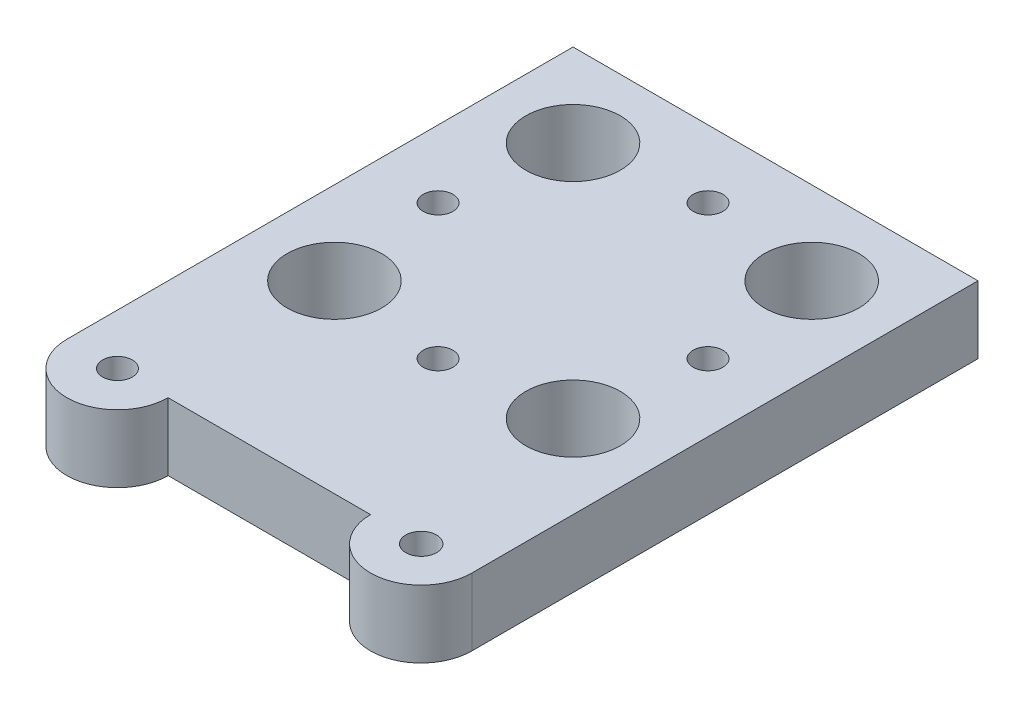
from build123d import *

# Parameters (mm, degrees)
SKETCH_1_W          = 60
SKETCH_1_H          = 60
EXTRUDE_1_DEPTH     = 10
SKETCH_2_R          = 2.2
CUT_EXTRUDE_1_DEPTH = 10
CUT_EXTRUDE_2_DEPTH = 3.5
SKETCH_4_R          = 7
CUT_EXTRUDE_3_DEPTH = 44.588989435
SKETCH_5_W          = 60
SKETCH_5_H          = 10
EXTRUDE_2_DEPTH     = 15
EXTRUDE_3_DEPTH     = 10
SKETCH_7_R          = 2.27814783
SKETCH_7_R_2        = 2.2
CUT_EXTRUDE_4_DEPTH = 62.288253361
SKETCH_8_R          = 4
CUT_EXTRUDE_5_DEPTH = 4


with BuildPart() as part:
    # 草图1 → 凸台-拉伸1 (new body)
    with BuildSketch(Plane(origin=(0, 0, 0), x_dir=(1, 0, 0), z_dir=(0, 1, 0))):
        Rectangle(SKETCH_1_W, SKETCH_1_H)
    extrude(amount=EXTRUDE_1_DEPTH)

    # 草图2 → 切除-拉伸1 (cut)
    with BuildSketch(Plane(origin=(0, 10, 0), x_dir=(1, 0, 0), z_dir=(0, 1, 0))):
        with Locations(Location((0, 20, 0), (0, 0, 270))):
            Circle(SKETCH_2_R)
        with Locations(Location((-20, 0, 0), (0, 0, 270))):
            Circle(SKETCH_2_R)
        with Locations(Location((0, -20, 0), (0, 0, 270))):
            Circle(SKETCH_2_R)
        with Locations(Location((20, 0, 0), (0, 0, 270))):
            Circle(SKETCH_2_R)
    extrude(amount=-CUT_EXTRUDE_1_DEPTH, mode=Mode.SUBTRACT)

    # 草图3 → 切除-拉伸2 (cut)
    with BuildSketch(Plane.XZ):
        Polygon((4, 20), (2, 23.464101615), (-2, 23.464101615), (-4, 20), (-2, 16.535898385), (2, 16.535898385), align=None)
        Polygon((-16, 0), (-18, 3.464101615), (-22, 3.464101615), (-24, 0), (-22, -3.464101615), (-18, -3.464101615), align=None)
        Polygon((24, 0), (22, 3.464101615), (18, 3.464101615), (16, 0), (18, -3.464101615), (22, -3.464101615), align=None)
        Polygon((4, -20), (2, -16.535898385), (-2, -16.535898385), (-4, -20), (-2, -23.464101615), (2, -23.464101615), align=None)
    extrude(amount=-CUT_EXTRUDE_2_DEPTH, mode=Mode.SUBTRACT)

    # 草图4 → 切除-拉伸3 (cut, through all)
    with BuildSketch(Plane.XZ):
        with Locations(Location((-17.67766953, 17.67766953, 0), (0, 0, 270))):
            Circle(SKETCH_4_R)
        with Locations(Location((-17.67766953, -17.67766953, 0), (0, 0, 270))):
            Circle(SKETCH_4_R)
        with Locations(Location((17.67766953, -17.67766953, 0), (0, 0, 270))):
            Circle(SKETCH_4_R)
        with Locations(Location((17.67766953, 17.67766953, 0), (0, 0, 270))):
            Circle(SKETCH_4_R)
    extrude(amount=-CUT_EXTRUDE_3_DEPTH, mode=Mode.SUBTRACT)

    # 草图5 → 凸台-拉伸2 (add)
    with BuildSketch(Plane.XY.offset(30)):
        with Locations((0, 5)):
            Rectangle(SKETCH_5_W, SKETCH_5_H)
    extrude(amount=EXTRUDE_2_DEPTH)

    # 草图6 → 凸台-拉伸3 (add)
    with BuildSketch(Plane(origin=(0, 10, 0), x_dir=(1, 0, 0), z_dir=(0, 1, 0))):
        with BuildLine():
            ThreePointArc((-30, -45), (-27.341229183, -50.728219619), (-21.25, -52.395099729))
            ThreePointArc((-21.25, -52.395099729), (-21.97543719, -49.830130464), (-22.392444444, -47.197369291))
            ThreePointArc((-22.392444444, -47.197369291), (-24.017131797, -46.593207805), (-24.7, -45))
            Line((-24.7, -45), (-30, -45))
        make_face()
        with BuildLine():
            ThreePointArc((-22.392444444, -47.197369291), (-21.97543719, -49.830130464), (-21.25, -52.395099729))
            ThreePointArc((-21.25, -52.395099729), (-16.771780381, -49.841229183), (-15, -45))
            Line((-15, -45), (-20.3, -45))
            ThreePointArc((-20.3, -45), (-20.906792195, -46.517131797), (-22.392444444, -47.197369291))
        make_face()
        with BuildLine():
            Line((-20.3, -45), (-15, -45))
            ThreePointArc((-15, -45), (-16.771780381, -40.158770817), (-21.25, -37.604900271))
            ThreePointArc((-21.25, -37.604900271), (-21.97543719, -40.169869536), (-22.392444444, -42.802630709))
            ThreePointArc((-22.392444444, -42.802630709), (-20.906792195, -43.482868203), (-20.3, -45))
        make_face()
        with BuildLine():
            ThreePointArc((-21.25, -37.604900271), (-27.341229183, -39.271780381), (-30, -45))
            Line((-30, -45), (-24.7, -45))
            ThreePointArc((-24.7, -45), (-24.017131797, -43.406792195), (-22.392444444, -42.802630709))
            ThreePointArc((-22.392444444, -42.802630709), (-21.97543719, -40.169869536), (-21.25, -37.604900271))
        make_face()
        with BuildLine():
            ThreePointArc((21.25, -52.395099729), (27.341229183, -50.728219619), (30, -45))
            Line((30, -45), (24.7, -45))
            ThreePointArc((24.7, -45), (24.017131797, -46.593207805), (22.392444444, -47.197369291))
            ThreePointArc((22.392444444, -47.197369291), (21.97543719, -49.830130464), (21.25, -52.395099729))
        make_face()
        with BuildLine():
            Line((24.7, -45), (30, -45))
            ThreePointArc((30, -45), (27.341229183, -39.271780381), (21.25, -37.604900271))
            ThreePointArc((21.25, -37.604900271), (21.97543719, -40.169869536), (22.392444444, -42.802630709))
            ThreePointArc((22.392444444, -42.802630709), (24.017131797, -43.406792195), (24.7, -45))
        make_face()
        with BuildLine():
            ThreePointArc((22.392444444, -42.802630709), (21.97543719, -40.169869536), (21.25, -37.604900271))
            ThreePointArc((21.25, -37.604900271), (16.771780381, -40.158770817), (15, -45))
            Line((15, -45), (20.3, -45))
            ThreePointArc((20.3, -45), (20.906792195, -43.482868203), (22.392444444, -42.802630709))
        make_face()
        with BuildLine():
            ThreePointArc((15, -45), (16.771780381, -49.841229183), (21.25, -52.395099729))
            ThreePointArc((21.25, -52.395099729), (21.97543719, -49.830130464), (22.392444444, -47.197369291))
            ThreePointArc((22.392444444, -47.197369291), (20.906792195, -46.517131797), (20.3, -45))
            Line((20.3, -45), (15, -45))
        make_face()
    extrude(amount=-EXTRUDE_3_DEPTH)

    # 草图7 → 切除-拉伸4 (cut, through all)
    with BuildSketch(Plane(origin=(0, 10, 0), x_dir=(1, 0, 0), z_dir=(0, 1, 0))):
        with Locations(Location((22.5, -45, 0), (0, 0, 270))):
            Circle(SKETCH_7_R)
        with Locations(Location((-22.5, -45, 0), (0, 0, 270))):
            Circle(SKETCH_7_R_2)
    extrude(amount=-CUT_EXTRUDE_4_DEPTH, mode=Mode.SUBTRACT)

    # 草图8 → 切除-拉伸5 (cut)
    with BuildSketch(Plane(origin=(0, 0, 0), x_dir=(-1, 0, 0), z_dir=(0, -1, 0))):
        with Locations(Location((-22.5, -45, 0), (0, 0, 90))):
            Circle(SKETCH_8_R)
        with Locations(Location((22.5, -45, 0), (0, 0, 90))):
            Circle(SKETCH_8_R)
    extrude(amount=-CUT_EXTRUDE_5_DEPTH, mode=Mode.SUBTRACT)


solid = part.part
